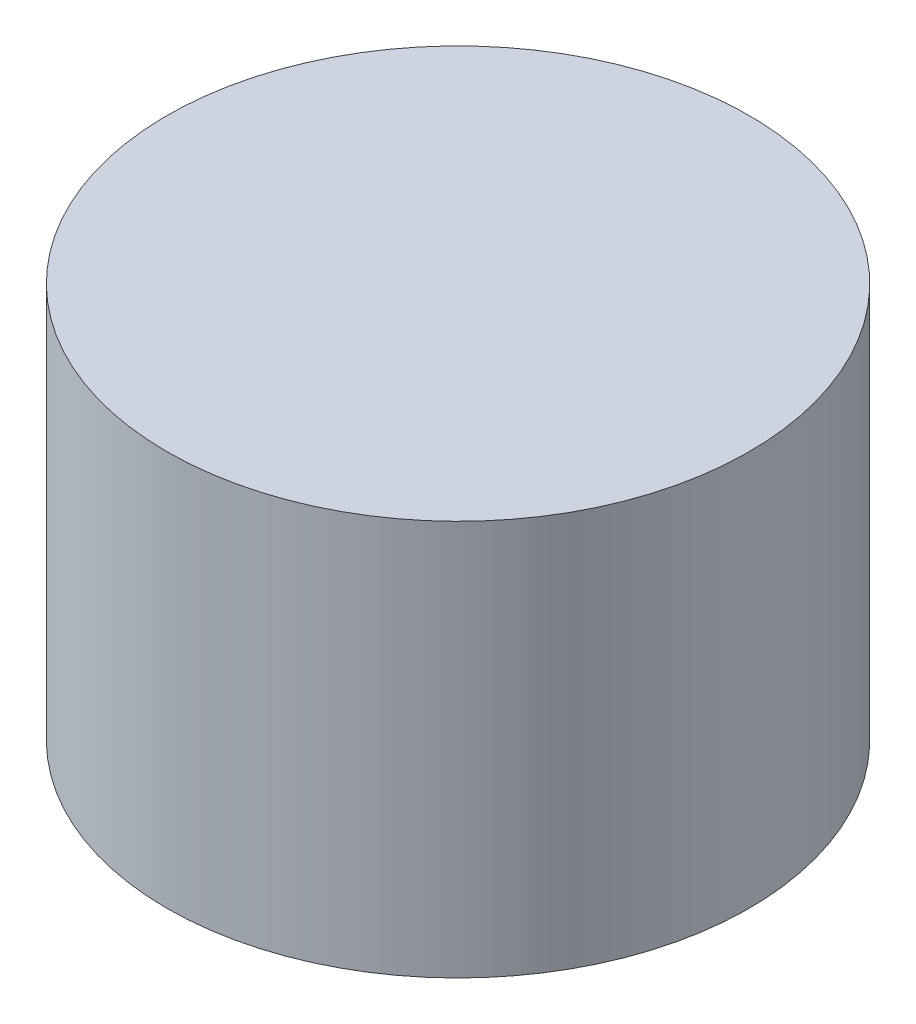
from build123d import *

# Parameters (mm, degrees)
ESQUISSE1_R        = 73.61
BOSS_EXTRU_1_DEPTH = 100


with BuildPart() as part:
    # Esquisse1 → Boss.-Extru.1 (new body)
    with BuildSketch(Plane(origin=(0, 0, 0), x_dir=(1, 0, 0), z_dir=(0, 1, 0))):
        with Locations(Location((0, 0, 0), (0, 0, 270))):
            Circle(ESQUISSE1_R)
    extrude(amount=BOSS_EXTRU_1_DEPTH)


solid = part.part
